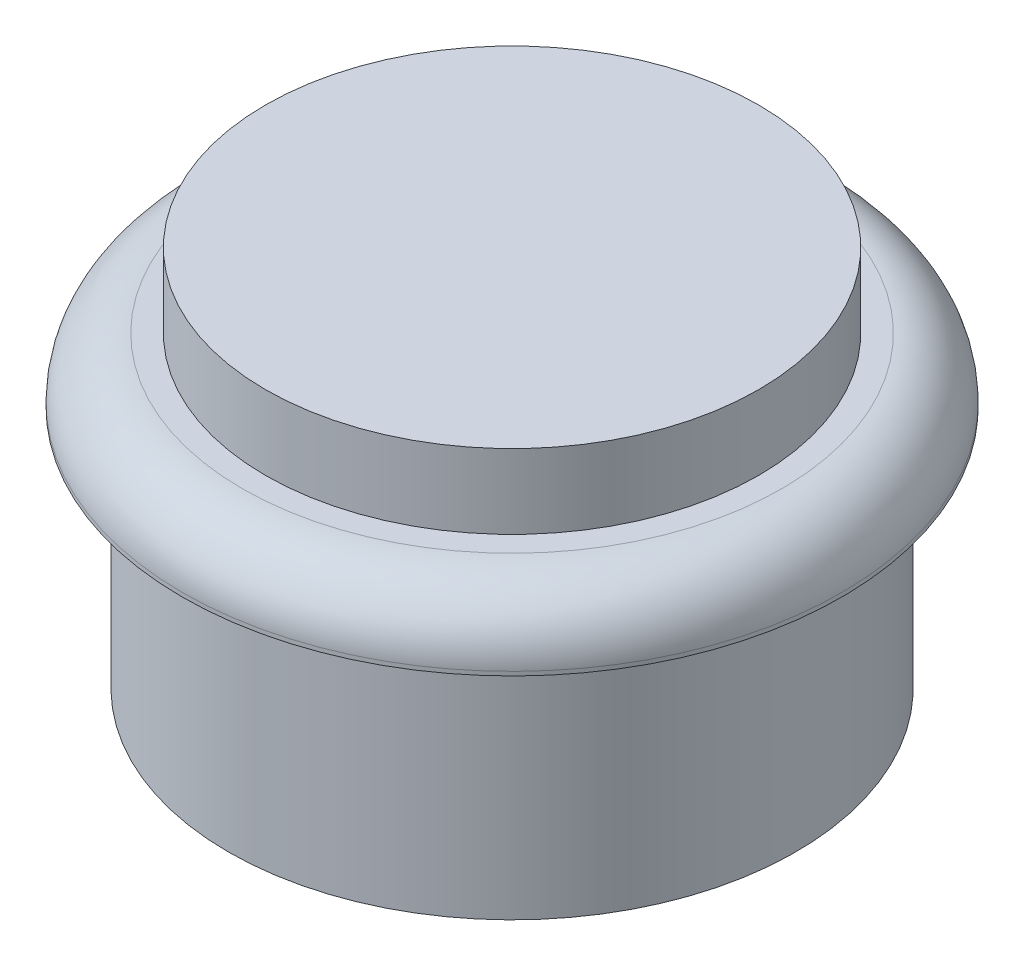
from build123d import *

# Parameters (mm, degrees)
SKETCH1_R           = 14.2
BOSS_EXTRUDE1_DEPTH = 12.2
SKETCH2_R           = 16.5
BOSS_EXTRUDE2_DEPTH = 3.2
FILLET1_R           = 3
SKETCH3_R           = 12.345
BOSS_EXTRUDE3_DEPTH = 3.72


with BuildPart() as part:
    # Sketch1 → Boss-Extrude1 (new body)
    with BuildSketch(Plane(origin=(0, 0, 0), x_dir=(1, 0, 0), z_dir=(0, 1, 0))):
        with Locations(Location((0, 0, 0), (0, 0, 270))):
            Circle(SKETCH1_R)
    extrude(amount=-BOSS_EXTRUDE1_DEPTH)

    # Sketch2 → Boss-Extrude2 (add)
    with BuildSketch(Plane(origin=(0, 0, 0), x_dir=(1, 0, 0), z_dir=(0, 1, 0))):
        with Locations(Location((0, 0, 0), (0, 0, 270))):
            Circle(SKETCH2_R)
    extrude(amount=BOSS_EXTRUDE2_DEPTH)

    # Fillet1
    fillet1_edges = [part.edges().sort_by_distance(p)[0] for p in [
        (0, 3.2, -16.5),
    ]]
    fillet(fillet1_edges, radius=FILLET1_R)

    # Sketch3 → Boss-Extrude3 (add)
    with BuildSketch(Plane(origin=(0, 3.2, 0), x_dir=(1, 0, 0), z_dir=(0, 1, 0))):
        with Locations(Location((0, 0, 0), (0, 0, 270))):
            Circle(SKETCH3_R)
    extrude(amount=BOSS_EXTRUDE3_DEPTH)


solid = part.part
